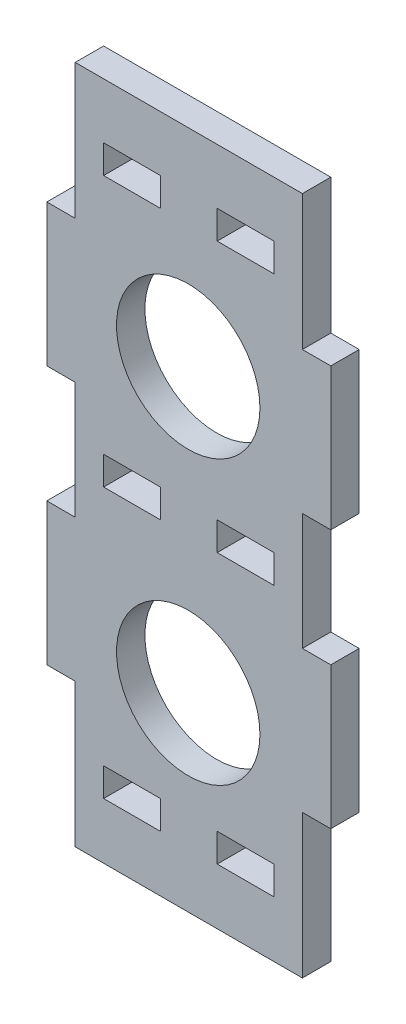
from build123d import *

# Parameters (mm, degrees)
MODEL_R         = 5.050911301
MODEL_W         = 4
MODEL_H         = 2
EXTRUDE_1_DEPTH = 2


with BuildPart() as part:
    # Model → 凸台-拉伸1 (new body)
    with BuildSketch(Plane.XY):
        Polygon((913.184335601, 571.907106356), (913.184335601, 563.673975647), (915.184335601, 563.673975647), (915.184335601, 553.673975647), (913.184335601, 553.673975647), (913.184335601, 543.570261409), (897.184335601, 543.570261409), (897.184335601, 553.673975647), (895.184335601, 553.673975647), (895.184335601, 563.673975647), (897.184335601, 563.673975647), (897.184335601, 571.907106356), (895.184335601, 571.907106356), (895.184335601, 581.907106356), (897.182393273, 581.907106356), (897.184335601, 591.419721737), (913.184335601, 591.419721737), (913.184335601, 581.907106356), (915.184335601, 581.907106356), (915.184335601, 571.907106356), align=None)
        with Locations((905.143744205, 556.935517453)):
            Circle(MODEL_R, mode=Mode.SUBTRACT)
        with Locations((905.143744205, 576.845149384)):
            Circle(MODEL_R, mode=Mode.SUBTRACT)
        with Locations((909.184335601, 586.518067913)):
            Rectangle(MODEL_W, MODEL_H, mode=Mode.SUBTRACT)
        with Locations((901.184335601, 586.518067913)):
            Rectangle(MODEL_W, MODEL_H, mode=Mode.SUBTRACT)
        with Locations((909.184335601, 567.518067913)):
            Rectangle(MODEL_W, MODEL_H, mode=Mode.SUBTRACT)
        with Locations((901.184335601, 567.518067913)):
            Rectangle(MODEL_W, MODEL_H, mode=Mode.SUBTRACT)
        with Locations((909.184335601, 548.518067913)):
            Rectangle(MODEL_W, MODEL_H, mode=Mode.SUBTRACT)
        with Locations((901.184335601, 548.518067913)):
            Rectangle(MODEL_W, MODEL_H, mode=Mode.SUBTRACT)
    extrude(amount=EXTRUDE_1_DEPTH)


solid = part.part
